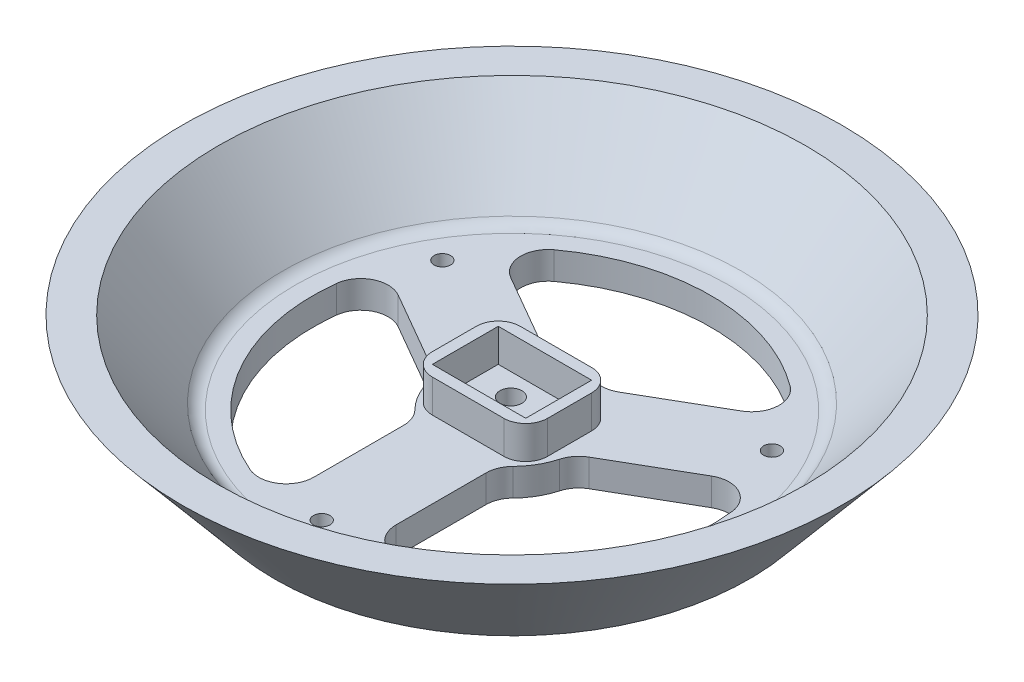
from build123d import *

# Parameters (mm, degrees)
SKETCH1_R             = 60
BOSS_EXTRUDE1_DEPTH   = 20
BOSS_EXTRUDE1_DRAFT   = -40
SHELL1_T              = -5
CUT_EXTRUDE2_DEPTH    = 20
SKETCH3_W             = 17
SKETCH3_H             = 12
BOSS_EXTRUDE2_DEPTH   = 6
F_3_0MM_DOWEL_HOLE1_D = 3
F_4_0MM_DOWEL_HOLE1_D = 4
FILLET1_R             = 5
FILLET2_R             = 3


with BuildPart() as part:
    # Sketch1 → Boss-Extrude1 (with draft: the straight prism first)
    with BuildSketch(Plane(origin=(0, 0, 0), x_dir=(1, 0, 0), z_dir=(0, 1, 0))):
        Circle(SKETCH1_R)
    extrude(amount=-BOSS_EXTRUDE1_DEPTH)
    # Boss-Extrude1: the draft: its side faces are tilted about the plane it starts from
    boss_extrude1_sides = [part.faces().sort_by_distance(p)[0] for p in [
        (-60, -10, 0),
    ]]
    draft(boss_extrude1_sides, Plane(origin=(0, 0, 0), x_dir=(1, 0, 0), z_dir=(0, 1, 0)), BOSS_EXTRUDE1_DRAFT)

    # Shell1
    shell1_openings = [part.faces().sort_by_distance(p)[0] for p in [
        (0, 0, 0),
    ]]
    offset(amount=SHELL1_T, openings=shell1_openings, kind=Kind.INTERSECTION)

    # Sketch2 → Cut-Extrude2 (cut)
    with BuildSketch(Plane.XZ.offset(20)):
        with BuildLine():
            ThreePointArc((-7.5, 35.432951589), (-31.365714462, 18.109003688), (-34.435836207, -11.221285266))
            Line((-34.435836207, -11.221285266), (-12.410254038, 1.495190528))
            ThreePointArc((-12.410254038, 1.495190528), (-10.825317547, 6.25), (-7.5, 10))
            Line((-7.5, 10), (-7.5, 35.432951589))
        make_face()
        with BuildLine():
            Line((12.410254038, 1.495190528), (34.435836207, -11.221285266))
            ThreePointArc((34.435836207, -11.221285266), (35.769689879, -5.680963323), (36.218007376, 0))
            ThreePointArc((36.218007376, 0), (28.136978459, 22.804703495), (7.5, 35.432951589))
            Line((7.5, 35.432951589), (7.5, 10))
            ThreePointArc((7.5, 10), (10.825317547, 6.25), (12.410254038, 1.495190528))
        make_face()
        with BuildLine():
            ThreePointArc((-26.935836207, -24.211666323), (0, -36.218007376), (26.935836207, -24.211666323))
            Line((26.935836207, -24.211666323), (4.910254038, -11.495190528))
            ThreePointArc((4.910254038, -11.495190528), (0, -12.5), (-4.910254038, -11.495190528))
            Line((-4.910254038, -11.495190528), (-26.935836207, -24.211666323))
        make_face()
    extrude(amount=-CUT_EXTRUDE2_DEPTH, mode=Mode.SUBTRACT)

    # Sketch3 → Boss-Extrude2 (add)
    with BuildSketch(Plane(origin=(0, -15, 0), x_dir=(1, 0, 0), z_dir=(0, 1, 0))):
        with BuildLine():
            Line((-6.5, -8), (6.5, -8))
            ThreePointArc((6.5, -8), (9.328427125, -6.828427125), (10.5, -4))
            Line((10.5, -4), (10.5, 4))
            ThreePointArc((10.5, 4), (9.328427125, 6.828427125), (6.5, 8))
            Line((6.5, 8), (-6.5, 8))
            ThreePointArc((-6.5, 8), (-9.328427125, 6.828427125), (-10.5, 4))
            Line((-10.5, 4), (-10.5, -4))
            ThreePointArc((-10.5, -4), (-9.328427125, -6.828427125), (-6.5, -8))
        make_face()
        Rectangle(SKETCH3_W, SKETCH3_H, mode=Mode.SUBTRACT)
    extrude(amount=BOSS_EXTRUDE2_DEPTH)

    # Ø3.0mm Dowel Hole1 (through all)
    with Locations(Plane(origin=(0, -15, 0), x_dir=(1, 0, 0), z_dir=(0, 1, 0))):
        with Locations((-29.999119987, 17.32), (29.999119987, 17.32), (0, -34.64)):
            Hole(F_3_0MM_DOWEL_HOLE1_D / 2)

    # Ø4.0mm Dowel Hole1 (through all)
    with Locations(Plane(origin=(0, -15, 0), x_dir=(1, 0, 0), z_dir=(0, 1, 0))):
        with Locations((-2.2, 2)):
            Hole(F_4_0MM_DOWEL_HOLE1_D / 2)

    # Fillet1
    fillet1_edges = [part.edges().sort_by_distance(p)[0] for p in [
        (-26.935836207, -17.5, -24.211666323),
        (-4.910254038, -17.5, -11.495190528),
        (4.910254038, -17.5, -11.495190528),
        (26.935836207, -17.5, -24.211666323),
        (34.435836207, -17.5, -11.221285266),
        (12.410254038, -17.5, 1.495190528),
        (7.5, -17.5, 10),
        (7.5, -17.5, 35.432951589),
        (-7.5, -17.5, 35.432951589),
        (-7.5, -17.5, 10),
        (-12.410254038, -17.5, 1.495190528),
        (-34.435836207, -17.5, -11.221285266),
    ]]
    fillet(fillet1_edges, radius=FILLET1_R)

    # Fillet2
    fillet2_edges = [part.edges().sort_by_distance(p)[0] for p in [
        (-40.886469086, -15, 0),
    ]]
    fillet(fillet2_edges, radius=FILLET2_R)


solid = part.part
